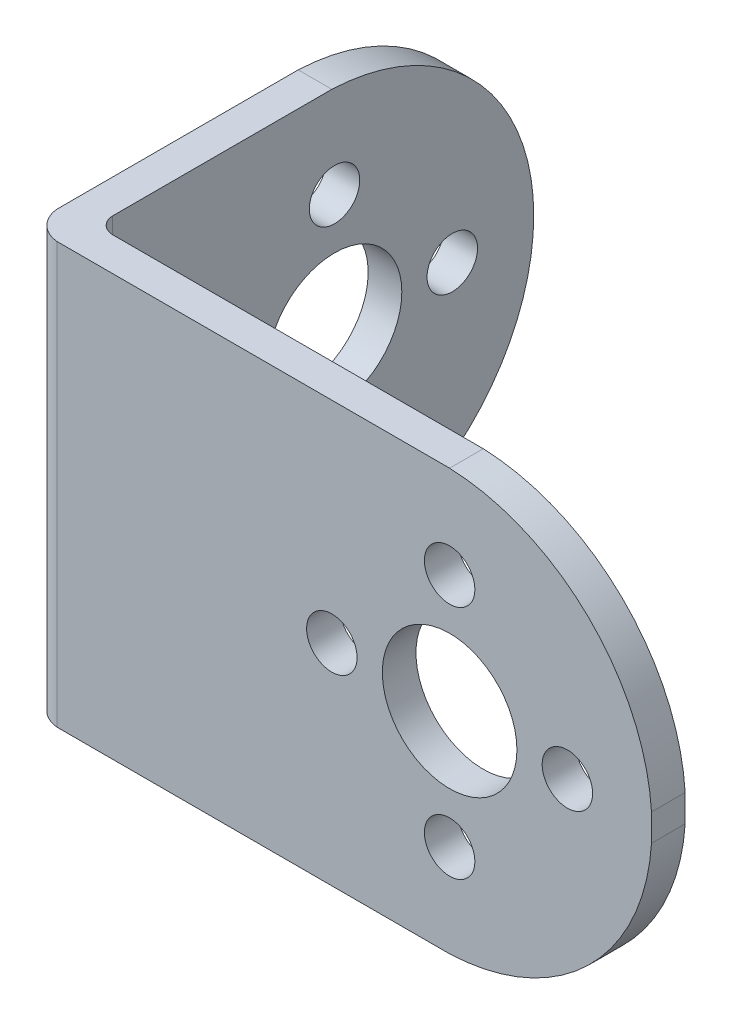
from build123d import *

# Parameters (mm, degrees)
BOSS_EXTRUDE1_DEPTH = 25
CUT_EXTRUDE1_DEPTH  = 25
CUT_EXTRUDE2_DEPTH  = 25
SKETCH5_R           = 4
SKETCH5_R_2         = 1.5
CUT_EXTRUDE3_DEPTH  = 25
SKETCH6_R           = 4
SKETCH6_R_2         = 1.5
CUT_EXTRUDE4_DEPTH  = 25


with BuildPart() as part:
    # Sketch1 → Boss-Extrude1 (new body)
    with BuildSketch(Plane(origin=(0, 0, 0), x_dir=(1, 0, 0), z_dir=(0, 1, 0))):
        with BuildLine():
            ThreePointArc((0, 1.659075407), (0.530256055, 0.530256055), (1.659075407, 0))
            Line((1.659075407, 0), (2, 0))
            Line((2, 0), (37, 0))
            Line((37, 0), (37, 2))
            Line((37, 2), (3.038729714, 2))
            ThreePointArc((3.038729714, 2), (3.003147911, 1.999369152), (2.967566108, 2))
            ThreePointArc((2.967566108, 2), (2.293369144, 2.293369144), (2, 2.967566108))
            Line((2, 2.967566108), (2, 28))
            Line((2, 28), (0, 28))
            Line((0, 28), (0, 2))
            Line((0, 2), (0, 1.659075407))
        make_face()
    extrude(amount=BOSS_EXTRUDE1_DEPTH)

    # Sketch2 → Cut-Extrude1 (cut)
    with BuildSketch(Plane.ZY):
        with BuildLine():
            ThreePointArc((-28, 12.5), (-24.514439297, 21.163861726), (-16, 25))
            Line((-16, 25), (-28, 25))
            Line((-28, 25), (-28, 12.5))
        make_face()
        with BuildLine():
            ThreePointArc((-16, 0), (-24.514439297, 3.836138274), (-28, 12.5))
            Line((-28, 12.5), (-28, 0))
            Line((-28, 0), (-16, 0))
        make_face()
    extrude(amount=-CUT_EXTRUDE1_DEPTH, mode=Mode.SUBTRACT)

    # Sketch4 → Cut-Extrude2 (cut)
    with BuildSketch(Plane.XY):
        with BuildLine():
            Line((37, 25), (25, 25))
            ThreePointArc((25, 25), (33.247279652, 21.458751494), (37, 13.305521912))
            Line((37, 13.305521912), (37, 25))
        make_face()
        with BuildLine():
            Line((37, 0), (37, 11.694478088))
            ThreePointArc((37, 11.694478088), (33.247279652, 3.541248506), (25, 0))
            Line((25, 0), (37, 0))
        make_face()
    extrude(amount=-CUT_EXTRUDE2_DEPTH, mode=Mode.SUBTRACT)

    # Sketch5 → Cut-Extrude3 (cut)
    with BuildSketch(Plane.XY):
        with Locations((25, 12.5)):
            Circle(SKETCH5_R)
        with Locations((25, 19.5)):
            Circle(SKETCH5_R_2)
        with Locations((32, 12.5)):
            Circle(SKETCH5_R_2)
        with Locations((25, 5.5)):
            Circle(SKETCH5_R_2)
        with Locations((18, 12.5)):
            Circle(SKETCH5_R_2)
    extrude(amount=-CUT_EXTRUDE3_DEPTH, mode=Mode.SUBTRACT)

    # Sketch6 → Cut-Extrude4 (cut)
    with BuildSketch(Plane.ZY):
        with Locations((-16.159075407, 12.5)):
            Circle(SKETCH6_R)
        with Locations((-16.159075407, 19.5)):
            Circle(SKETCH6_R_2)
        with Locations((-9.159075407, 12.5)):
            Circle(SKETCH6_R_2)
        with Locations((-16.159075407, 5.5)):
            Circle(SKETCH6_R_2)
        with Locations((-23.159075407, 12.5)):
            Circle(SKETCH6_R_2)
    extrude(amount=-CUT_EXTRUDE4_DEPTH, mode=Mode.SUBTRACT)


solid = part.part
